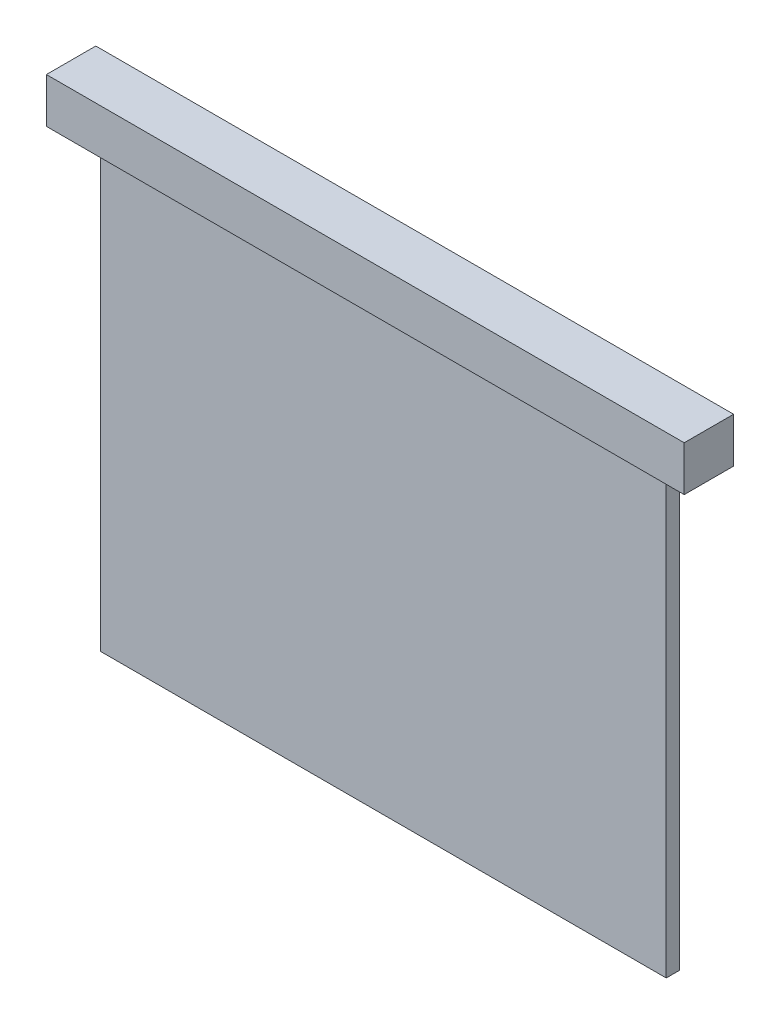
from build123d import *

# Parameters (mm, degrees)
SKETCH3_W           = 63
SKETCH3_H           = 49.6
BOSS_EXTRUDE1_DEPTH = 1.5
SKETCH10_W          = 2
SKETCH10_H          = 5
SKETCH10_W_2        = 1.5
BOSS_EXTRUDE2_DEPTH = 63
SKETCH11_W          = 5.5
SKETCH11_H          = 5.002720327
BOSS_EXTRUDE3_DEPTH = 4
SKETCH12_W          = 5.5
SKETCH12_H          = 5
BOSS_EXTRUDE4_DEPTH = 4


with BuildPart() as part:
    # Sketch3 → Boss-Extrude1 (new body)
    with BuildSketch(Plane.XY):
        Rectangle(SKETCH3_W, SKETCH3_H)
    extrude(amount=BOSS_EXTRUDE1_DEPTH)

    # Sketch10 → Boss-Extrude2 (add)
    with BuildSketch(Plane(origin=(31.5, 0, 0), x_dir=(0, 0, -1), z_dir=(1, 0, 0))):
        with Locations((-2.5, 27.3)):
            Rectangle(SKETCH10_W, SKETCH10_H)
        with Locations((-0.75, 27.3)):
            Rectangle(SKETCH10_W_2, SKETCH10_H)
        with Locations((1, 27.3)):
            Rectangle(SKETCH10_W, SKETCH10_H)
    extrude(amount=-BOSS_EXTRUDE2_DEPTH)

    # Sketch11 → Boss-Extrude3 (add)
    with BuildSketch(Plane(origin=(31.5, 0, 0), x_dir=(0, 0, -1), z_dir=(1, 0, 0))):
        with Locations((-0.75, 27.298639837)):
            Rectangle(SKETCH11_W, SKETCH11_H)
    extrude(amount=BOSS_EXTRUDE3_DEPTH)

    # Sketch12 → Boss-Extrude4 (add)
    with BuildSketch(Plane.ZY.offset(31.5)):
        with Locations((0.75, 27.3)):
            Rectangle(SKETCH12_W, SKETCH12_H)
    extrude(amount=BOSS_EXTRUDE4_DEPTH)


solid = part.part
